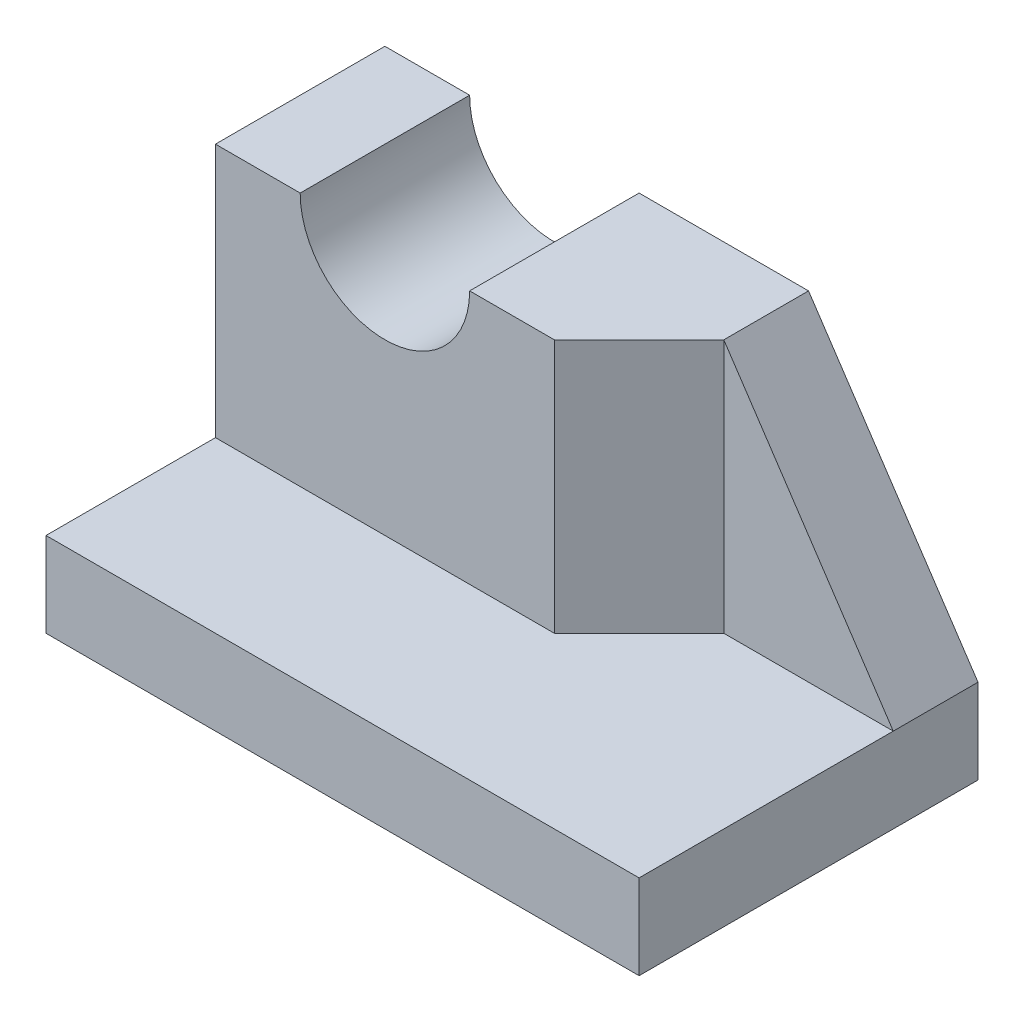
from build123d import *

# Parameters (mm, degrees)
EXTRUDE_1_DEPTH     = 20
SKETCH_2_OUTSIDE_W  = 46
SKETCH_2_OUTSIDE_H  = 31
CUT_EXTRUDE_1_DEPTH = 20
SKETCH_4_R          = 5
CUT_EXTRUDE_2_DEPTH = 42.533119315


with BuildPart() as part:
    # 草圖1 → 填料-伸長1 (new body)
    with BuildSketch(Plane.XY):
        Polygon((25, 20), (35, 5), (35, 0), (0, 0), (0, 20), align=None)
    extrude(amount=EXTRUDE_1_DEPTH)

    # 草圖2 outside → 除料-伸長1 (cut)
    with BuildSketch(Plane(origin=(0, 5, 0), x_dir=(-1, 0, 0), z_dir=(0, -1, 0))):
        with Locations((-17.5, -10)):
            Rectangle(SKETCH_2_OUTSIDE_W, SKETCH_2_OUTSIDE_H)
        Polygon((-35, 0), (-25, 0), (0, 0), (0, -10), (-20, -10), (-25, -5), (-35, -5), align=None, mode=Mode.SUBTRACT)
    extrude(amount=-CUT_EXTRUDE_1_DEPTH, mode=Mode.SUBTRACT)

    # 草圖4 → 除料-伸長2 (cut, through all)
    with BuildSketch(Plane.XY.offset(10)):
        with Locations((10, 20)):
            Circle(SKETCH_4_R)
    extrude(amount=-CUT_EXTRUDE_2_DEPTH, mode=Mode.SUBTRACT)


solid = part.part
